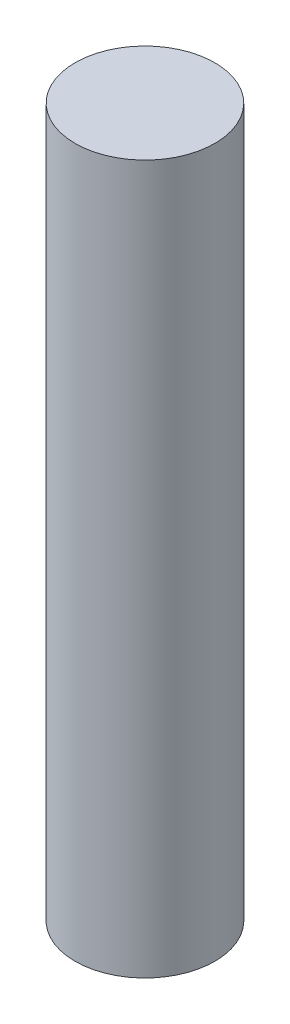
from build123d import *

# Parameters (mm, degrees)
SKETCH1_R           = 14.8
BOSS_EXTRUDE1_DEPTH = 150


with BuildPart() as part:
    # Sketch1 → Boss-Extrude1 (new body)
    with BuildSketch(Plane(origin=(0, 0, 0), x_dir=(1, 0, 0), z_dir=(0, 1, 0))):
        with Locations(Location((0, 0, 0), (0, 0, 270))):
            Circle(SKETCH1_R)
    extrude(amount=BOSS_EXTRUDE1_DEPTH)


solid = part.part
